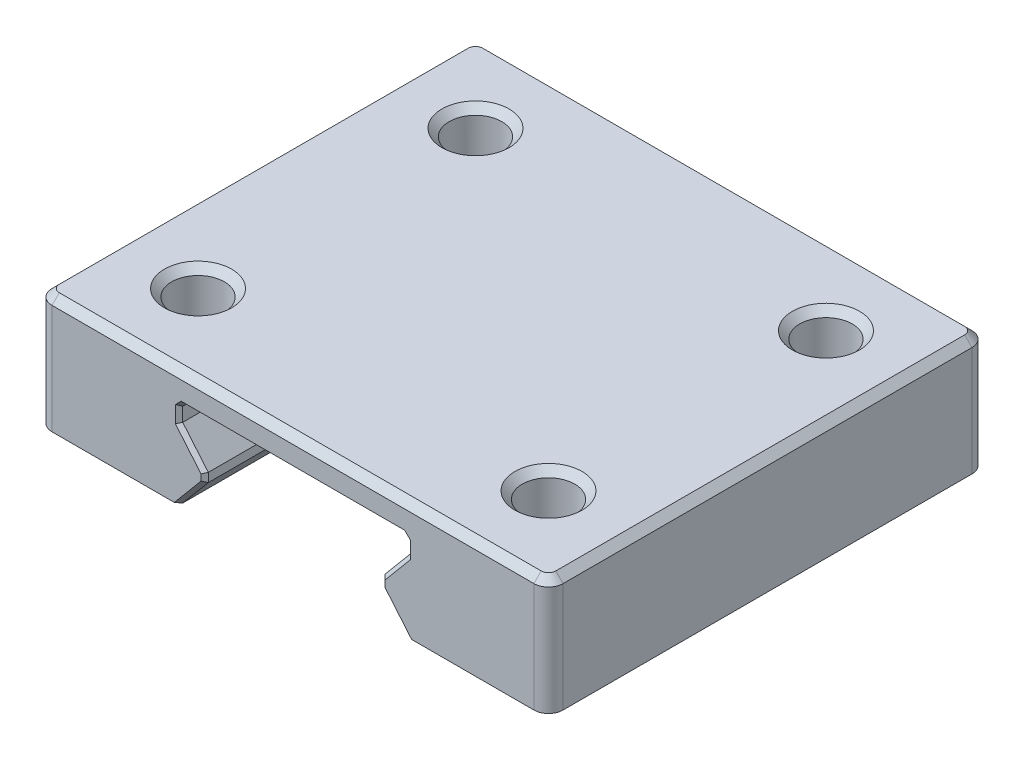
from build123d import *

# Parameters (mm, degrees)
P_IDAT_VYSUNUT_M1_DEPTH  = 30
SKICA2_R                 = 1.8
ODEBRAT_VYSUNUT_M1_DEPTH = 8
ZAOBLIT1_R               = 1
ZKOSEN_2_SIZE            = 0.25
ZKOSEN_3_SIZE            = 0.5
ZKOSEN_4_SIZE            = 0.5


with BuildPart() as part:
    # Skica1 → Přidat vysunutím1 (new body)
    with BuildSketch(Plane.XY):
        Polygon((0, 0), (9.7, 0), (11.453718229, 2.09), (11.453718229, 2.7), (9.7, 4.79), (9.7, 5.74), (9.95, 5.99), (25.05, 5.99), (25.3, 5.74), (25.3, 4.79), (23.546281771, 2.7), (23.546281771, 2.09), (25.3, 0), (35, 0), (35, 8), (0, 8), align=None)
    extrude(amount=P_IDAT_VYSUNUT_M1_DEPTH)

    # Skica2 → Odebrat vysunutím1 (cut)
    with BuildSketch(Plane(origin=(0, 8, 0), x_dir=(1, 0, 0), z_dir=(0, 1, 0))):
        with Locations(Location((5.5, -5.5, 0), (0, 0, 180))):
            Circle(SKICA2_R)
        with Locations(Location((29.5, -5.5, 0), (0, 0, 180))):
            Circle(SKICA2_R)
        with Locations(Location((5.5, -24.5, 0), (0, 0, 180))):
            Circle(SKICA2_R)
        with Locations(Location((29.5, -24.5, 0), (0, 0, 180))):
            Circle(SKICA2_R)
    extrude(amount=-ODEBRAT_VYSUNUT_M1_DEPTH, mode=Mode.SUBTRACT)

    # Zaoblit1
    zaoblit1_edges = [part.edges().sort_by_distance(p)[0] for p in [
        (35, 4, 0),
        (0, 4, 0),
        (0, 4, 30),
        (35, 4, 30),
    ]]
    fillet(zaoblit1_edges, radius=ZAOBLIT1_R)

    # Zkosení2
    zkosen_2_edges = [part.edges().sort_by_distance(p)[0] for p in [
        (10.576859115, 1.045, 30),
        (11.453718229, 2.395, 30),
        (24.423140885, 1.045, 0),
        (23.546281771, 2.395, 0),
        (24.423140885, 3.745, 0),
        (25.3, 5.265, 0),
        (25.175, 5.865, 0),
        (17.5, 5.99, 0),
        (9.825, 5.865, 0),
        (9.7, 5.265, 0),
        (10.576859115, 3.745, 0),
        (11.453718229, 2.395, 0),
        (10.576859115, 3.745, 30),
        (10.576859115, 1.045, 0),
        (9.7, 5.265, 30),
        (9.825, 5.865, 30),
        (17.5, 5.99, 30),
        (25.175, 5.865, 30),
        (25.3, 5.265, 30),
        (24.423140885, 3.745, 30),
        (23.546281771, 2.395, 30),
        (24.423140885, 1.045, 30),
    ]]
    chamfer(zkosen_2_edges, length=ZKOSEN_2_SIZE)

    # Zkosení3
    zkosen_3_edges = [part.edges().sort_by_distance(p)[0] for p in [
        (17.5, 8, 30),
        (0, 8, 15),
        (17.5, 8, 0),
        (35, 8, 15),
        (34.707106781, 8, 0.292893219),
        (34.707106781, 8, 29.707106781),
        (0.292893219, 8, 0.292893219),
        (0.292893219, 8, 29.707106781),
    ]]
    chamfer(zkosen_3_edges, length=ZKOSEN_3_SIZE)

    # Zkosení4
    zkosen_4_edges = [part.edges().sort_by_distance(p)[0] for p in [
        (31.3, 8, 5.5),
        (7.3, 8, 24.5),
        (31.3, 8, 24.5),
        (7.3, 8, 5.5),
    ]]
    chamfer(zkosen_4_edges, length=ZKOSEN_4_SIZE)


solid = part.part
